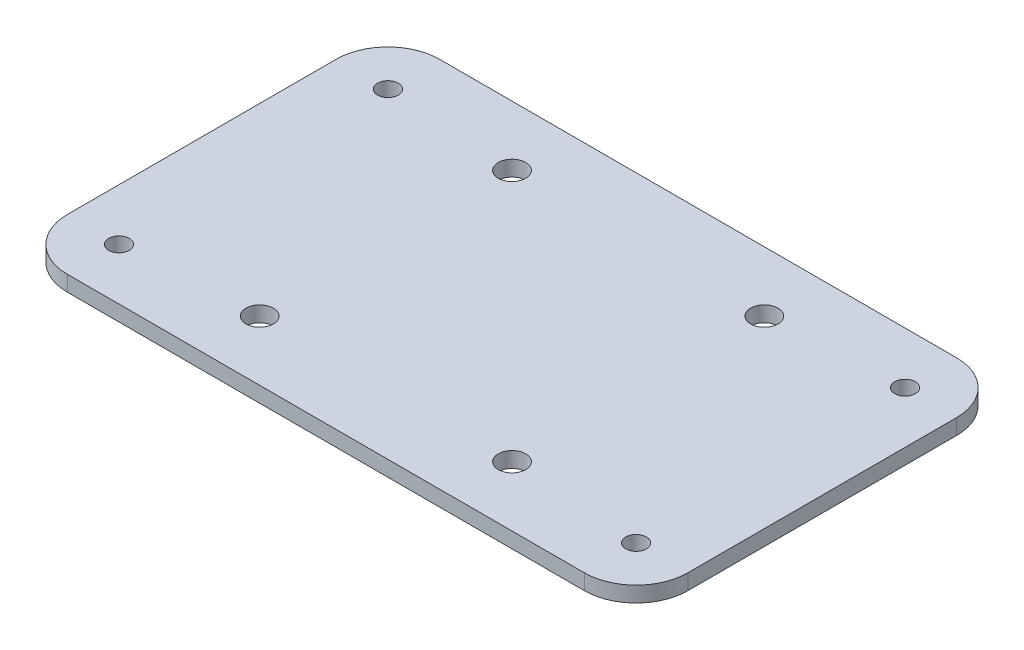
from build123d import *

# Parameters (mm, degrees)
SKETCH_1_W      = 120
SKETCH_1_H      = 72
SKETCH_1_R      = 2.65
SKETCH_1_R_2    = 2
EXTRUDE_1_DEPTH = 3
FILLET_1_R      = 10


with BuildPart() as part:
    # 草图1 → 凸台-拉伸1 (new body)
    with BuildSketch(Plane(origin=(0, 0, 0), x_dir=(1, 0, 0), z_dir=(0, 1, 0))):
        Rectangle(SKETCH_1_W, SKETCH_1_H)
        with Locations(Location((-24.395183951, 24.395183951, 0), (0, 0, 270))):
            Circle(SKETCH_1_R, mode=Mode.SUBTRACT)
        with Locations(Location((24.395183951, 24.395183951, 0), (0, 0, 270))):
            Circle(SKETCH_1_R, mode=Mode.SUBTRACT)
        with Locations(Location((24.395183951, -24.395183951, 0), (0, 0, 270))):
            Circle(SKETCH_1_R, mode=Mode.SUBTRACT)
        with Locations(Location((-24.395183951, -24.395183951, 0), (0, 0, 270))):
            Circle(SKETCH_1_R, mode=Mode.SUBTRACT)
        with Locations(Location((-50, 26, 0), (0, 0, 270))):
            Circle(SKETCH_1_R_2, mode=Mode.SUBTRACT)
        with Locations(Location((-50, -26, 0), (0, 0, 270))):
            Circle(SKETCH_1_R_2, mode=Mode.SUBTRACT)
        with Locations(Location((50, -26, 0), (0, 0, 90))):
            Circle(SKETCH_1_R_2, mode=Mode.SUBTRACT)
        with Locations(Location((50, 26, 0), (0, 0, 90))):
            Circle(SKETCH_1_R_2, mode=Mode.SUBTRACT)
    extrude(amount=EXTRUDE_1_DEPTH)

    # 圆角1
    fillet_1_edges = [part.edges().sort_by_distance(p)[0] for p in [
        (60, 1.5, 36),
        (-60, 1.5, 36),
        (-60, 1.5, -36),
        (60, 1.5, -36),
    ]]
    fillet(fillet_1_edges, radius=FILLET_1_R)


solid = part.part
